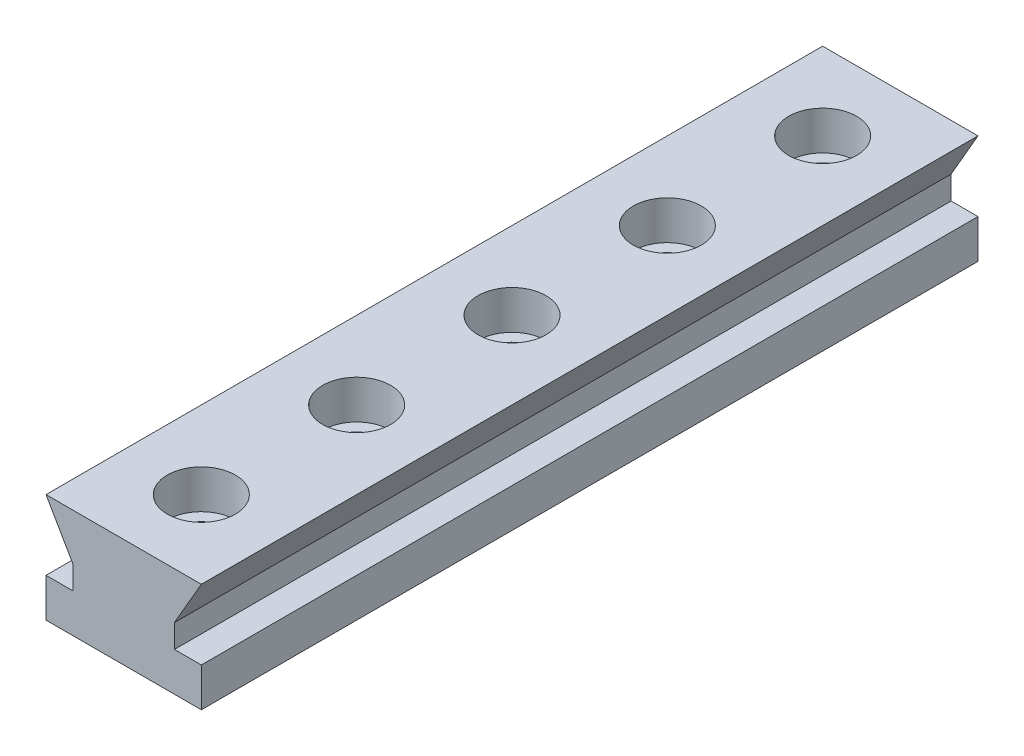
from build123d import *

# Parameters (mm, degrees)
BOSS_EXTRUDE1_DEPTH                              = 127
CBORE_FOR_1_4_SOCKET_HEAD_CAP_SCREW1_D           = 7.14248
CBORE_FOR_1_4_SOCKET_HEAD_CAP_SCREW1_CBORE_D     = 11.1125
CBORE_FOR_1_4_SOCKET_HEAD_CAP_SCREW1_CBORE_DEPTH = 6.35


with BuildPart() as part:
    # Sketch1 → Boss-Extrude1 (new body)
    with BuildSketch(Plane.XY):
        Polygon((0, 0), (25.4, 0), (21.000590949, -7.62), (21.000590949, -11.43), (25.4, -11.43), (25.4, -17.78), (0, -17.78), (0, -11.43), (4.399409051, -11.43), (4.399409051, -7.62), align=None)
    extrude(amount=BOSS_EXTRUDE1_DEPTH)

    # CBORE for 1/4 Socket Head Cap Screw1 (through all)
    with Locations(Plane(origin=(0, 0, 0), x_dir=(1, 0, 0), z_dir=(0, 1, 0))):
        with Locations((12.7, -12.7), (12.7, -38.1), (12.7, -63.5), (12.7, -88.9), (12.7, -114.3)):
            CounterBoreHole(CBORE_FOR_1_4_SOCKET_HEAD_CAP_SCREW1_D / 2, CBORE_FOR_1_4_SOCKET_HEAD_CAP_SCREW1_CBORE_D / 2, CBORE_FOR_1_4_SOCKET_HEAD_CAP_SCREW1_CBORE_DEPTH)


solid = part.part
